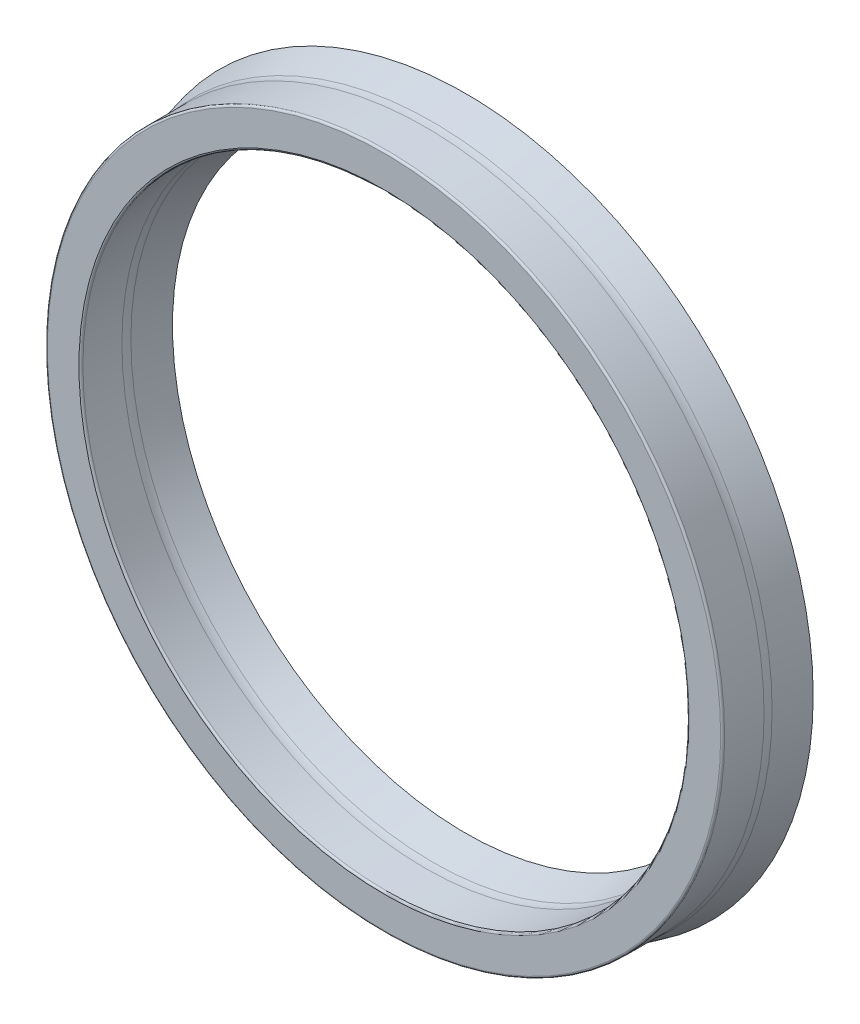
from build123d import *


with BuildPart() as part:
    # Sketch1 → Revolve1 (revolve)
    with BuildSketch(Plane(origin=(0, 0, 0), x_dir=(0, 0, -1), z_dir=(1, 0, 0)), mode=Mode.PRIVATE) as revolve1_sk:
        with BuildLine():
            Line((0, 30.5), (0, 33.65))
            ThreePointArc((0, 33.65), (0.058578644, 33.791421356), (0.2, 33.85))
            Line((0.2, 33.85), (4.135594176, 33.85))
            ThreePointArc((4.135594176, 33.85), (4.497341053, 33.871889996), (4.853808838, 33.937240535))
            Line((4.853808838, 33.937240535), (8.15, 34.75))
            Line((8.15, 34.75), (8.15, 33.5))
            Line((8.15, 33.5), (4.91, 32.555))
            ThreePointArc((4.91, 32.555), (4.55005161, 32.0678162), (4.923849273, 31.591175658))
            Line((4.923849273, 31.591175658), (8.15, 30.75))
            Line((8.15, 30.75), (8.15, 29.3))
            Line((8.15, 29.3), (4.889181759, 30.193374861))
            ThreePointArc((4.889181759, 30.193374861), (4.496398447, 30.273224225), (4.096476318, 30.3))
            Line((4.096476318, 30.3), (0.2, 30.3))
            ThreePointArc((0.2, 30.3), (0.058578644, 30.358578644), (0, 30.5))
        make_face()
    revolve(revolve1_sk.sketch.rotate(Axis((0, 0, 0), (0, 0, -1)), 90), axis=Axis((0, 0, 0), (0, 0, -1)))


solid = part.part
